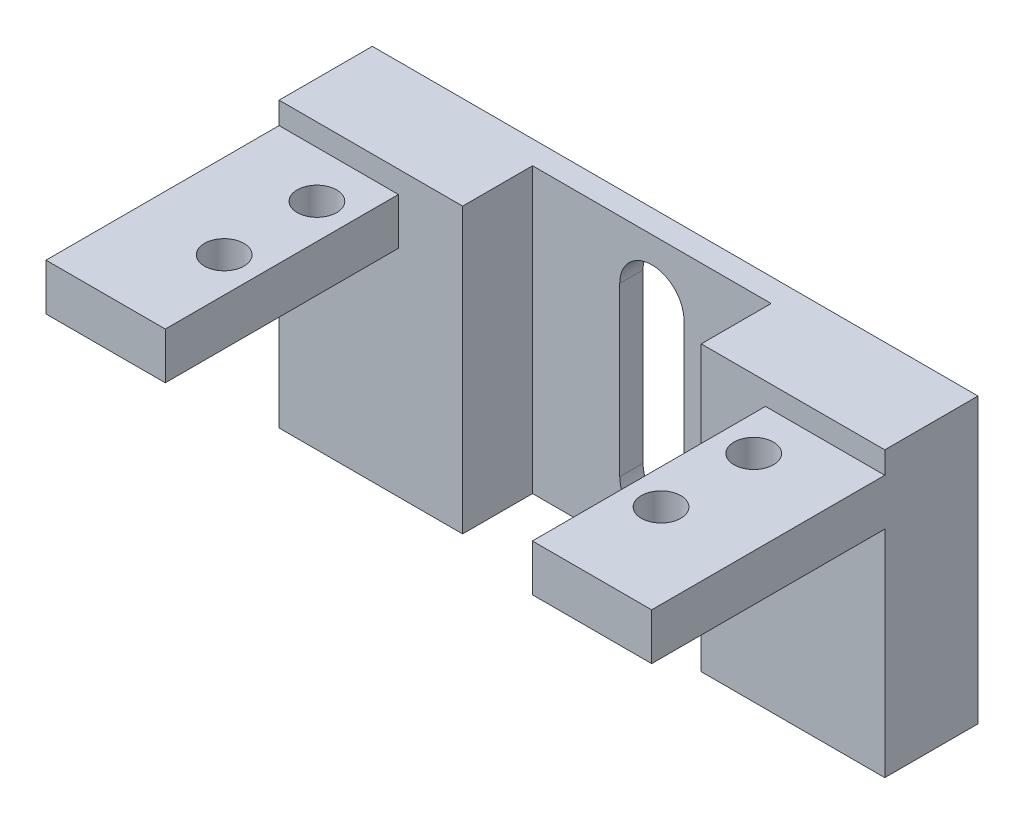
from build123d import *

# Parameters (mm, degrees)
SKETCH1_W           = 66
SKETCH1_H           = 27.619999878
BOSS_EXTRUDE1_DEPTH = 2.54
BOSS_EXTRUDE2_DEPTH = 26
SKETCH3_W           = 13
SKETCH3_H           = 5.08
BOSS_EXTRUDE3_DEPTH = 25.4
CUT_EXTRUDE1_REACH  = 78.124
CUT_EXTRUDE3_REACH  = 79.029
SKETCH5_R           = 2.15
BOSS_EXTRUDE4_DEPTH = 2.4
CUT_EXTRUDE4_REACH  = 82.023


with BuildPart() as part:
    # Sketch1 → Boss-Extrude1 (new body)
    with BuildSketch(Plane(origin=(0, 0, 0), x_dir=(1, 0, 0), z_dir=(0, 1, 0))):
        with Locations((33, 13.809999939)):
            Rectangle(SKETCH1_W, SKETCH1_H)
    extrude(amount=BOSS_EXTRUDE1_DEPTH)

    # Sketch2 → Boss-Extrude2 (add)
    with BuildSketch(Plane(origin=(0, 2.54, 0), x_dir=(1, 0, 0), z_dir=(0, 1, 0))):
        Polygon((0, 27.619999878), (66, 27.619999878), (66, 17.459999878), (46, 17.459999878), (46, 25.079999878), (20, 25.079999878), (20, 17.459999878), (0, 17.459999878), align=None)
    extrude(amount=BOSS_EXTRUDE2_DEPTH)

    # Sketch3 → Boss-Extrude3 (add)
    with BuildSketch(Plane.XY.offset(-17.459999878)):
        with Locations((6.5, 26)):
            Rectangle(SKETCH3_W, SKETCH3_H)
        with Locations((59.5, 26)):
            Rectangle(SKETCH3_W, SKETCH3_H)
    extrude(amount=BOSS_EXTRUDE3_DEPTH)

    # Sketch4 → Cut-Extrude1 (cut, up to next)
    with BuildSketch(Plane(origin=(0, 2.54, 0), x_dir=(1, 0, 0), z_dir=(0, 1, 0)), mode=Mode.PRIVATE) as cut_extrude1_sk1:
        Polygon((46, 17.459999878), (66, 17.459999878), (66, 0), (0, 0), (0, 17.459999878), (20, 17.459999878), (20, 25.079999878), (46, 25.079999878), align=None)
    cut_extrude1_tool1 = extrude(cut_extrude1_sk1.sketch, amount=-CUT_EXTRUDE1_REACH, mode=Mode.PRIVATE) & part.part
    add(cut_extrude1_tool1.solids().sort_by_distance((33, 2.54, -10.569661))[0], mode=Mode.SUBTRACT)

    # Sketch5 → Cut-Extrude3 (cut, up to next)
    with BuildSketch(Plane(origin=(0, 28.54, 0), x_dir=(1, 0, 0), z_dir=(0, 1, 0)), mode=Mode.PRIVATE) as cut_extrude3_sk1:
        with Locations(Location((56.8, 12.379999878, 0), (0, 0, 270))):
            Circle(SKETCH5_R)
    cut_extrude3_tool1 = extrude(cut_extrude3_sk1.sketch, amount=-CUT_EXTRUDE3_REACH, mode=Mode.PRIVATE) & part.part
    # Sketch5 → Cut-Extrude3 (cut, up to next)
    with BuildSketch(Plane(origin=(0, 28.54, 0), x_dir=(1, 0, 0), z_dir=(0, 1, 0)), mode=Mode.PRIVATE) as cut_extrude3_sk2:
        with Locations(Location((56.8, 2.279999878, 0), (0, 0, 270))):
            Circle(SKETCH5_R)
    cut_extrude3_tool2 = extrude(cut_extrude3_sk2.sketch, amount=-CUT_EXTRUDE3_REACH, mode=Mode.PRIVATE) & part.part
    cut_extrude3_1 = cut_extrude3_tool1.solids().sort_by_distance((56.8, 28.54, -12.38))[0]
    add(cut_extrude3_1, mode=Mode.SUBTRACT)
    cut_extrude3_2 = cut_extrude3_tool2.solids().sort_by_distance((56.8, 28.54, -2.28))[0]
    add(cut_extrude3_2, mode=Mode.SUBTRACT)
    cut_extrude3 = cut_extrude3_1 + cut_extrude3_2  # Cut-Extrude3 as one shape, for the pattern or mirror that repeats it

    # Mirror1: Cut-Extrude3 across plane
    add(cut_extrude3.mirror(Plane.ZY.offset(-33)), mode=Mode.SUBTRACT)

    # Sketch6 → Boss-Extrude4 (add)
    with BuildSketch(Plane(origin=(0, 28.54, 0), x_dir=(1, 0, 0), z_dir=(0, 1, 0))):
        Polygon((0, 27.619999878), (66, 27.619999878), (66, 17.459999878), (46, 17.459999878), (46, 25.079999878), (20, 25.079999878), (20, 17.459999878), (0, 17.459999878), align=None)
    extrude(amount=BOSS_EXTRUDE4_DEPTH)

    # Sketch7 → Cut-Extrude4 (cut, up to next)
    with BuildSketch(Plane.XY.offset(-25.079999878), mode=Mode.PRIVATE) as cut_extrude4_sk1:
        with BuildLine():
            Line((36.5, 24.59), (36.5, 6.35))
            ThreePointArc((36.5, 6.35), (33, 2.85), (29.5, 6.35))
            Line((29.5, 6.35), (29.5, 24.59))
            ThreePointArc((29.5, 24.59), (33, 28.09), (36.5, 24.59))
        make_face()
    cut_extrude4_tool1 = extrude(cut_extrude4_sk1.sketch, amount=-CUT_EXTRUDE4_REACH, mode=Mode.PRIVATE) & part.part
    add(cut_extrude4_tool1.solids().sort_by_distance((33, 15.47, -25.08))[0], mode=Mode.SUBTRACT)


solid = part.part
